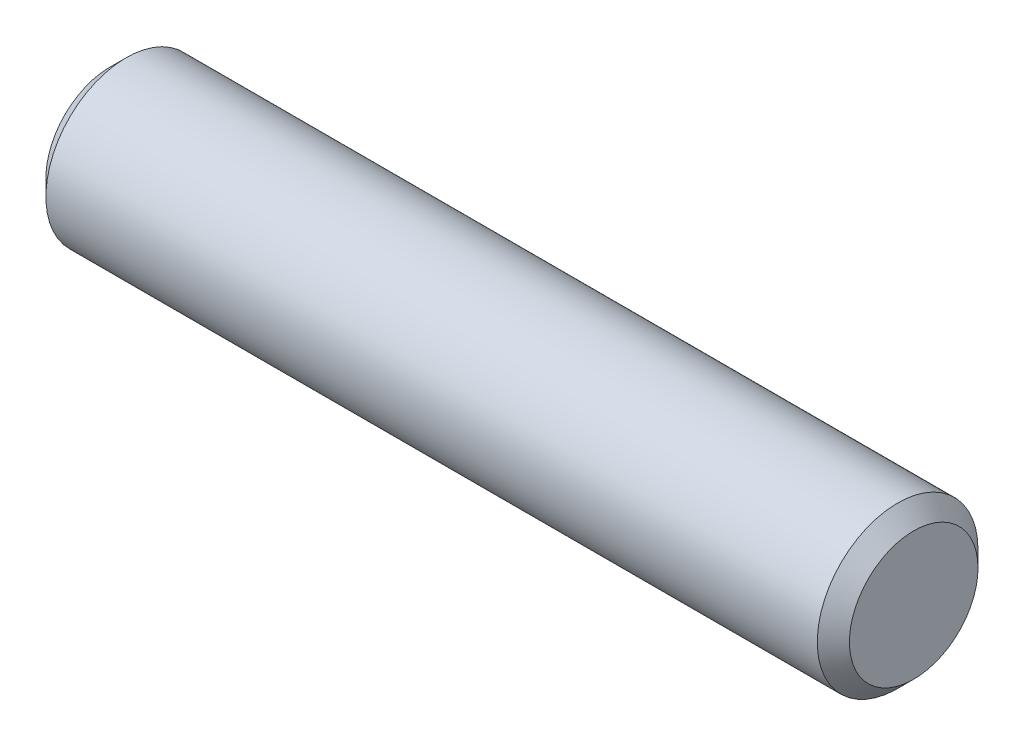
from build123d import *

# Parameters (mm, degrees)
EXTRUDE1_DEPTH      = 15.875
EXTRUDE1_DEPTH_BACK = 15.875
SKETCH2_R           = 3.175
CHAMFER1_SIZE       = 0.635


with BuildPart() as part:
    # Sketch2 → Extrude1 (new, two sides: drawn at the far end of the back side and taken through both)
    with BuildSketch(Plane(origin=(0, 0, 0), x_dir=(0, 0, -1), z_dir=(1, 0, 0)).offset(-EXTRUDE1_DEPTH_BACK)):
        Circle(SKETCH2_R)
    extrude(amount=EXTRUDE1_DEPTH + EXTRUDE1_DEPTH_BACK)

    # Chamfer1
    chamfer1_edges = [part.edges().sort_by_distance(p)[0] for p in [
        (-15.875, 0, 3.175),
        (15.875, 0, 3.175),
    ]]
    chamfer(chamfer1_edges, length=CHAMFER1_SIZE)


solid = part.part
